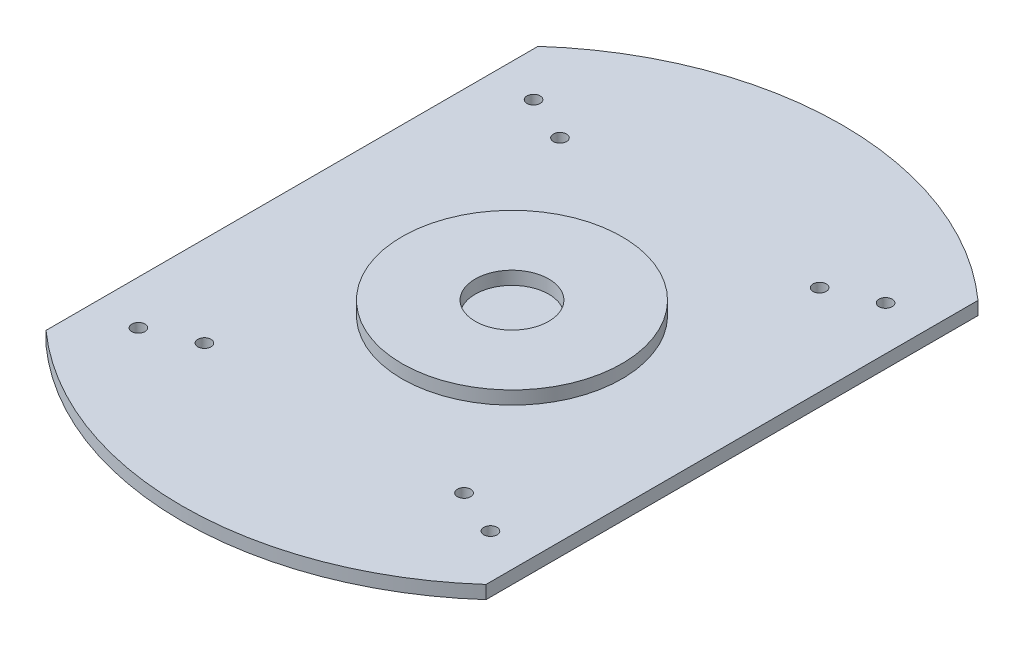
from build123d import *

# Parameters (mm, degrees)
SKETCH1_R           = 1.5
BOSS_EXTRUDE1_DEPTH = 3
SKETCH2_R           = 25
SKETCH2_R_2         = 8.35
BOSS_EXTRUDE2_DEPTH = 3


with BuildPart() as part:
    # Sketch1 → Boss-Extrude1 (new body)
    with BuildSketch(Plane(origin=(0, 0, 0), x_dir=(1, 0, 0), z_dir=(0, 1, 0))):
        with BuildLine():
            Line((50, 0), (50, 55.901699437))
            ThreePointArc((50, 55.901699437), (0, 75), (-50, 55.901699437))
            Line((-50, 55.901699437), (-50, 0))
            Line((-50, 0), (-50, -55.901699437))
            ThreePointArc((-50, -55.901699437), (0, -75), (50, -55.901699437))
            Line((50, -55.901699437), (50, 0))
        make_face()
        with Locations(Location((-40, -44.9, 0), (0, 0, 270))):
            Circle(SKETCH1_R, mode=Mode.SUBTRACT)
        with Locations(Location((-29.5, -40.4, 0), (0, 0, 270))):
            Circle(SKETCH1_R, mode=Mode.SUBTRACT)
        with Locations(Location((29.5, -40.4, 0), (0, 0, 270))):
            Circle(SKETCH1_R, mode=Mode.SUBTRACT)
        with Locations(Location((-29.5, 40.4, 0), (0, 0, 270))):
            Circle(SKETCH1_R, mode=Mode.SUBTRACT)
        with Locations(Location((29.5, 40.4, 0), (0, 0, 270))):
            Circle(SKETCH1_R, mode=Mode.SUBTRACT)
        with Locations(Location((40, 44.9, 0), (0, 0, 270))):
            Circle(SKETCH1_R, mode=Mode.SUBTRACT)
        with Locations(Location((-40, 44.9, 0), (0, 0, 270))):
            Circle(SKETCH1_R, mode=Mode.SUBTRACT)
        with Locations(Location((40, -44.9, 0), (0, 0, 270))):
            Circle(SKETCH1_R, mode=Mode.SUBTRACT)
    extrude(amount=BOSS_EXTRUDE1_DEPTH)

    # Sketch2 → Boss-Extrude2 (add)
    with BuildSketch(Plane(origin=(0, 3, 0), x_dir=(1, 0, 0), z_dir=(0, 1, 0))):
        with Locations(Location((0, 0, 0), (0, 0, 270))):
            Circle(SKETCH2_R)
        with Locations(Location((0, 0, 0), (0, 0, 270))):
            Circle(SKETCH2_R_2, mode=Mode.SUBTRACT)
    extrude(amount=BOSS_EXTRUDE2_DEPTH)


solid = part.part
